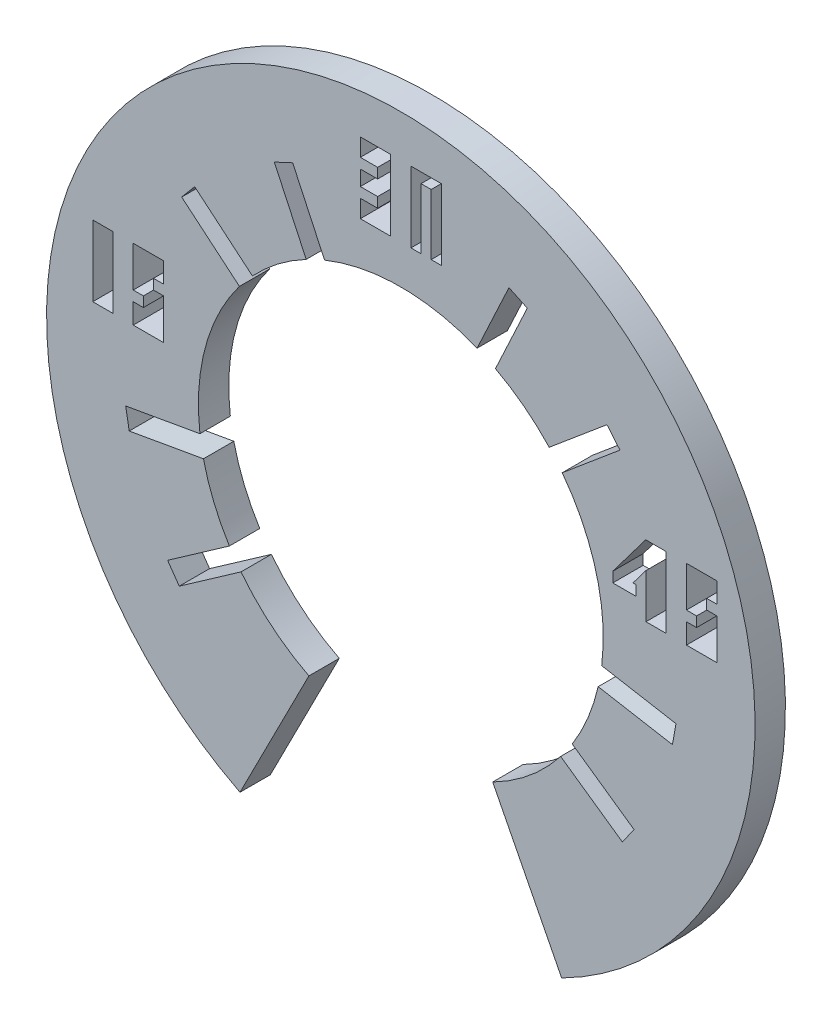
from build123d import *

# Parameters (mm, degrees)
BOSS_EXTRUDE1_DEPTH = 1.5
SKETCH2_W           = 1
SKETCH2_H           = 3.5
CUT_EXTRUDE1_DEPTH  = 1.5


with BuildPart() as part:
    # Sketch1 → Boss-Extrude1 (new body)
    with BuildSketch(Plane.XY):
        with BuildLine():
            Line((-4.539904997, -8.910065242), (-7.944833745, -15.592614173))
            ThreePointArc((-7.944833745, -15.592614173), (0, 17.5), (7.944833745, -15.592614173))
            Line((7.944833745, -15.592614173), (4.539904997, -8.910065242))
            ThreePointArc((4.539904997, -8.910065242), (0, 10), (-4.539904997, -8.910065242))
        make_face()
    extrude(amount=BOSS_EXTRUDE1_DEPTH)

    # Sketch2 → Cut-Extrude1 (cut)
    with BuildSketch(Plane.XY.offset(1.5)):
        with Locations((-14.718025133, 3.507588082)):
            Rectangle(SKETCH2_W, SKETCH2_H)
        Polygon((-13.218025133, 5.257588082), (-13.218025133, 3.257588082), (-12.718025133, 3.257588082), (-12.718025133, 2.757588082), (-13.218025133, 2.757588082), (-13.218025133, 1.757588082), (-11.718025133, 1.757588082), (-11.718025133, 3.757588082), (-12.218025133, 3.757588082), (-12.218025133, 4.257588082), (-11.718025133, 4.257588082), (-11.718025133, 5.257588082), align=None)
        Polygon((-2, 15.418453076), (-0.5, 15.418453076), (-0.5, 11.918453076), (-2, 11.918453076), (-2, 12.793453076), (-1.1452971, 12.793453076), (-1.1452971, 13.293453076), (-2, 13.293453076), (-2, 14.043453076), (-1.1452971, 14.043453076), (-1.1452971, 14.543453076), (-2, 14.543453076), align=None)
        Polygon((0.5, 15.418453076), (0.5, 11.918453076), (1, 11.918453076), (1, 12.418453076), (1, 14.918453076), (1.5, 14.918453076), (1.5, 12.418453076), (1.5, 11.918453076), (2, 11.918453076), (2, 15.418453076), align=None)
        Polygon((12.097744761, 5.231352171), (13.110444891, 5.231352171), (13.110444891, 1.731375213), (12.110444891, 1.731375213), (12.110444891, 3.922086384), (11.470557234, 3.073526548), (11.610444891, 3.073526548), (11.610444891, 2.572345702), (10.470557234, 2.572345702), (10.470557234, 3.073526548), align=None)
        Polygon((14.110444891, 5.231352171), (14.110444891, 3.231375213), (14.610444891, 3.231375213), (14.610444891, 2.731375213), (14.110444891, 2.731375213), (14.110444891, 1.731375213), (15.610444891, 1.731375213), (15.610444891, 3.731375213), (15.110444891, 3.731375213), (15.110444891, 4.231375213), (15.610444891, 4.231375213), (15.610444891, 5.231352171), align=None)
        Polygon((-11.232578871, -7.865136399), (-11.519367089, -7.455560377), (-8.468062853, -5.319014149), (-7.473400559, -4.622544113), (-6.899824123, -5.441696158), (-7.894486417, -6.138166194), (-10.945790653, -8.274712421), align=None)
        Polygon((-13.504123972, -2.381141407), (-13.590948061, -1.888737531), (-9.922583819, -1.24190594), (-8.726772681, -1.031052172), (-8.553124503, -2.015859925), (-9.748935641, -2.226713693), (-13.417299884, -2.873545284), align=None)
        Polygon((-10.504343712, 8.814190935), (-10.182949908, 9.197213156), (-7.329469079, 6.802858445), (-6.399293139, 6.022348157), (-7.042080748, 5.256303714), (-7.972256688, 6.036814002), (-10.825737517, 8.431168713), align=None)
        Polygon((-5.795130453, 12.427697361), (-5.341976559, 12.639006492), (-3.76774269, 9.263051065), (-3.254574893, 8.162559174), (-4.16088268, 7.739940912), (-4.674050477, 8.840432803), (-6.248284346, 12.21638823), align=None)
        Polygon((5.795130453, 12.427697361), (6.248284346, 12.21638823), (4.674050477, 8.840432803), (4.16088268, 7.739940912), (3.254574893, 8.162559174), (3.76774269, 9.263051065), (5.341976559, 12.639006492), align=None)
        Polygon((10.504343712, 8.814190935), (10.825737517, 8.431168713), (7.972256688, 6.036814002), (7.042080748, 5.256303714), (6.399293139, 6.022348157), (7.329469079, 6.802858445), (10.182949908, 9.197213156), align=None)
        Polygon((13.504123972, -2.381141407), (13.417299884, -2.873545284), (9.748935641, -2.226713693), (8.553124503, -2.015859925), (8.726772681, -1.031052172), (9.922583819, -1.24190594), (13.590948061, -1.888737531), align=None)
        Polygon((11.232578871, -7.865136399), (10.945790653, -8.274712421), (7.894486417, -6.138166194), (6.899824123, -5.441696158), (7.473400559, -4.622544113), (8.468062853, -5.319014149), (11.519367089, -7.455560377), align=None)
    extrude(amount=-CUT_EXTRUDE1_DEPTH, mode=Mode.SUBTRACT)


solid = part.part
